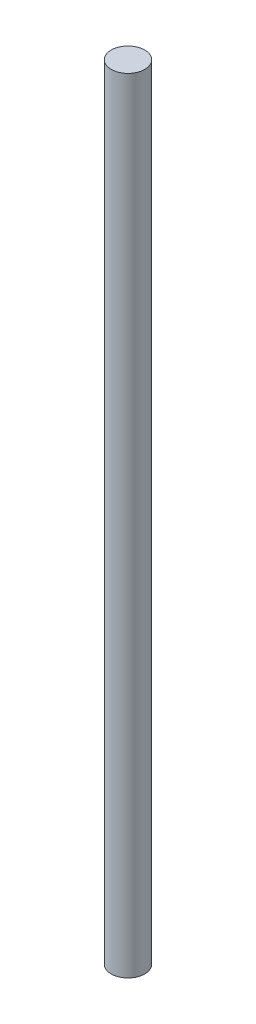
from build123d import *

# Parameters (mm, degrees)
CROQUIS1_R              = 1.5
SALIENTE_EXTRUIR1_DEPTH = 70


with BuildPart() as part:
    # Croquis1 → Saliente-Extruir1 (new body)
    with BuildSketch(Plane(origin=(0, 0, 0), x_dir=(1, 0, 0), z_dir=(0, 1, 0))):
        with Locations(Location((0, 0, 0), (0, 0, 270))):
            Circle(CROQUIS1_R)
    extrude(amount=SALIENTE_EXTRUIR1_DEPTH)


solid = part.part
